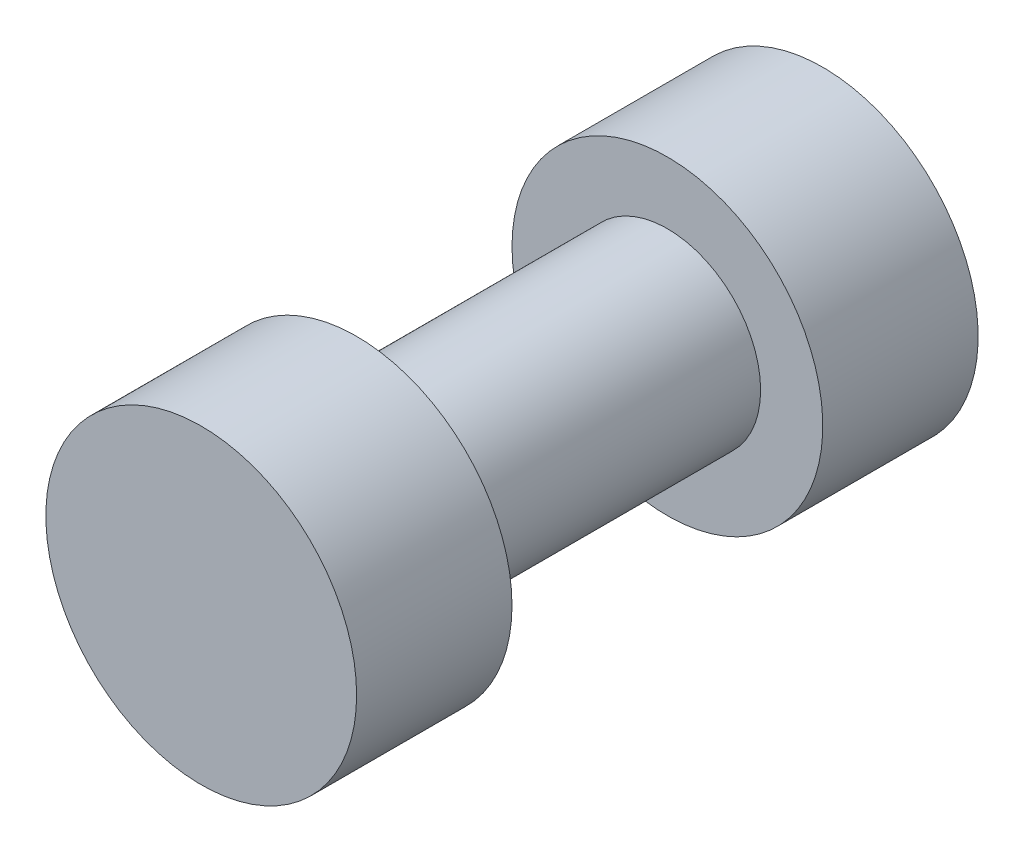
from build123d import *

# Parameters (mm, degrees)
ESQUISSE1_R        = 3
BOSS_EXTRU_1_DEPTH = 10
ESQUISSE2_R        = 5
BOSS_EXTRU_3_DEPTH = 5
BOSS_EXTRU_4_START = 5
ESQUISSE3_R        = 5
BOSS_EXTRU_4_DEPTH = 5


with BuildPart() as part:
    # Esquisse1 → Boss.-Extru.1 (new body)
    with BuildSketch(Plane.XY):
        Circle(ESQUISSE1_R)
    extrude(amount=BOSS_EXTRU_1_DEPTH)

    # Esquisse2 → Boss.-Extru.3 (add)
    with BuildSketch(Plane.XY.offset(10)):
        Circle(ESQUISSE2_R)
    extrude(amount=BOSS_EXTRU_3_DEPTH)

    # Esquisse3 → Boss.-Extru.4 (add)
    with BuildSketch(Plane(origin=(0, 0, 0), x_dir=(-1, 0, 0), z_dir=(0, 0, -1)).offset(BOSS_EXTRU_4_START)):
        with Locations(Location((0, 0, 0), (0, 0, 180))):
            Circle(ESQUISSE3_R)
    extrude(amount=-BOSS_EXTRU_4_DEPTH)


solid = part.part
